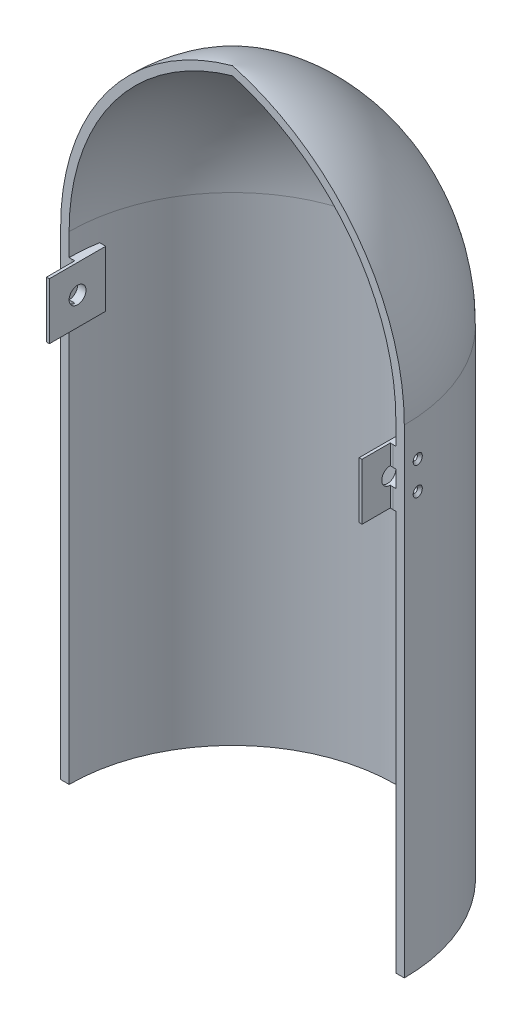
from build123d import *

# Parameters (mm, degrees)
REVOLVE1_ANGLE                                       = 180
SKETCH2_W                                            = 3
SKETCH2_H                                            = 20
BOSS_EXTRUDE1_DEPTH                                  = 10
SKETCH4_W                                            = 1
SKETCH4_H                                            = 20
CUT_EXTRUDE1_DEPTH                                   = 0.01
CSK_FOR_M1_6_COUNTERSUNK_FLAT_HEAD_SCREW_D           = 1.8
CSK_FOR_M1_6_COUNTERSUNK_FLAT_HEAD_SCREW_DEPTH       = 5
CSK_FOR_M1_6_COUNTERSUNK_FLAT_HEAD_SCREW_CSINK_D     = 3.6
CSK_FOR_M1_6_COUNTERSUNK_FLAT_HEAD_SCREW_CSINK_ANGLE = 90
CSK_FOR_M1_6_COUNTERSUNK_FLAT_HEAD_SCREW_TIP         = 0.540774557
CSK_FOR_M1_6_COUNTERSUNK_FLAT_HEAD_S_2_D             = 1.8
CSK_FOR_M1_6_COUNTERSUNK_FLAT_HEAD_S_2_DEPTH         = 5
CSK_FOR_M1_6_COUNTERSUNK_FLAT_HEAD_S_2_CSINK_D       = 3.6
CSK_FOR_M1_6_COUNTERSUNK_FLAT_HEAD_S_2_CSINK_ANGLE   = 90
CSK_FOR_M1_6_COUNTERSUNK_FLAT_HEAD_S_2_TIP           = 0.540774557
CSK_FOR_M1_6_COUNTERSUNK_FLAT_HEAD_S_3_D             = 1.8
CSK_FOR_M1_6_COUNTERSUNK_FLAT_HEAD_S_3_DEPTH         = 5
CSK_FOR_M1_6_COUNTERSUNK_FLAT_HEAD_S_3_CSINK_D       = 3.6
CSK_FOR_M1_6_COUNTERSUNK_FLAT_HEAD_S_3_CSINK_ANGLE   = 90
CSK_FOR_M1_6_COUNTERSUNK_FLAT_HEAD_S_3_TIP           = 0.540774557
SKETCH10_W                                           = 1
SKETCH10_H                                           = 20
BOSS_EXTRUDE2_DEPTH                                  = 10.01
SKETCH12_R                                           = 3
CUT_EXTRUDE4_DEPTH                                   = 3
CUT_EXTRUDE5_START                                   = -3
SKETCH13_R                                           = 3
CUT_EXTRUDE5_DEPTH                                   = 3


with BuildPart() as part:
    # Sketch1 → Revolve1 (revolve)
    with BuildSketch(Plane.XY):
        with BuildLine():
            Line((61, 170), (61, 0))
            Line((61, 0), (58, 0))
            Line((58, 0), (58, 170))
            ThreePointArc((58, 170), (41.873834296, 218.154039035), (0, 246.884627213))
            Line((0, 246.884627213), (0, 250))
            ThreePointArc((0, 250), (44.010282534, 220.301590432), (61, 170))
        make_face()
    revolve(axis=Axis((0, 0, 0), (0, 1, 0)), revolution_arc=REVOLVE1_ANGLE)

    # Sketch2 → Boss-Extrude1 (add)
    with BuildSketch(Plane.XY):
        with Locations((56.5, 152)):
            Rectangle(SKETCH2_W, SKETCH2_H)
        with Locations((-56.5, 152)):
            Rectangle(SKETCH2_W, SKETCH2_H)
    extrude(amount=-BOSS_EXTRUDE1_DEPTH)

    # Sketch4 → Cut-Extrude1 (cut)
    with BuildSketch(Plane.XY):
        with Locations((-56.5, 152)):
            Rectangle(SKETCH4_W, SKETCH4_H)
        with Locations((56.5, 152)):
            Rectangle(SKETCH4_W, SKETCH4_H)
    extrude(amount=-CUT_EXTRUDE1_DEPTH, mode=Mode.SUBTRACT)

    # CSK for M1.6 Countersunk Flat Head Screw2
    with Locations(Plane(origin=(60.795081967, 157.001615154, -4.995799095), x_dir=(0.081898345823, 0, 0.996640687987), z_dir=(0.996640687987, 0, -0.081898345823))):
        with Locations((0, 0)):
            CounterSinkHole(CSK_FOR_M1_6_COUNTERSUNK_FLAT_HEAD_SCREW_D / 2, CSK_FOR_M1_6_COUNTERSUNK_FLAT_HEAD_SCREW_CSINK_D / 2, depth=CSK_FOR_M1_6_COUNTERSUNK_FLAT_HEAD_SCREW_DEPTH, counter_sink_angle=CSK_FOR_M1_6_COUNTERSUNK_FLAT_HEAD_SCREW_CSINK_ANGLE)
            with Locations((0, 0, -(CSK_FOR_M1_6_COUNTERSUNK_FLAT_HEAD_SCREW_DEPTH + CSK_FOR_M1_6_COUNTERSUNK_FLAT_HEAD_SCREW_TIP / 2))):  # 118° drill point
                Cone(0, CSK_FOR_M1_6_COUNTERSUNK_FLAT_HEAD_SCREW_D / 2, CSK_FOR_M1_6_COUNTERSUNK_FLAT_HEAD_SCREW_TIP, mode=Mode.SUBTRACT)

    # CSK for M1.6 Countersunk Flat Head S 2
    with Locations(Plane(origin=(60.795081967, 147.001615154, -4.995799095), x_dir=(0.081897976852, 0, 0.996640718307), z_dir=(0.996640718307, 0, -0.081897976852))):
        with Locations((0, 0)):
            CounterSinkHole(CSK_FOR_M1_6_COUNTERSUNK_FLAT_HEAD_S_2_D / 2, CSK_FOR_M1_6_COUNTERSUNK_FLAT_HEAD_S_2_CSINK_D / 2, depth=CSK_FOR_M1_6_COUNTERSUNK_FLAT_HEAD_S_2_DEPTH, counter_sink_angle=CSK_FOR_M1_6_COUNTERSUNK_FLAT_HEAD_S_2_CSINK_ANGLE)
            with Locations((0, 0, -(CSK_FOR_M1_6_COUNTERSUNK_FLAT_HEAD_S_2_DEPTH + CSK_FOR_M1_6_COUNTERSUNK_FLAT_HEAD_S_2_TIP / 2))):  # 118° drill point
                Cone(0, CSK_FOR_M1_6_COUNTERSUNK_FLAT_HEAD_S_2_D / 2, CSK_FOR_M1_6_COUNTERSUNK_FLAT_HEAD_S_2_TIP, mode=Mode.SUBTRACT)

    # CSK for M1.6 Countersunk Flat Head S 3
    with Locations(Plane(origin=(-60.795081967, 147.001615154, -4.995799095), x_dir=(0.081897976852, 0, -0.996640718307), z_dir=(-0.996640718307, 0, -0.081897976852))):
        with Locations((0, 0), (0, -10)):
            CounterSinkHole(CSK_FOR_M1_6_COUNTERSUNK_FLAT_HEAD_S_3_D / 2, CSK_FOR_M1_6_COUNTERSUNK_FLAT_HEAD_S_3_CSINK_D / 2, depth=CSK_FOR_M1_6_COUNTERSUNK_FLAT_HEAD_S_3_DEPTH, counter_sink_angle=CSK_FOR_M1_6_COUNTERSUNK_FLAT_HEAD_S_3_CSINK_ANGLE)
            with Locations((0, 0, -(CSK_FOR_M1_6_COUNTERSUNK_FLAT_HEAD_S_3_DEPTH + CSK_FOR_M1_6_COUNTERSUNK_FLAT_HEAD_S_3_TIP / 2))):  # 118° drill point
                Cone(0, CSK_FOR_M1_6_COUNTERSUNK_FLAT_HEAD_S_3_D / 2, CSK_FOR_M1_6_COUNTERSUNK_FLAT_HEAD_S_3_TIP, mode=Mode.SUBTRACT)

    # Sketch10 → Boss-Extrude2 (add)
    with BuildSketch(Plane.XY.offset(-0.01)):
        with Locations((-55.5, 152)):
            Rectangle(SKETCH10_W, SKETCH10_H)
        with Locations((55.5, 152)):
            Rectangle(SKETCH10_W, SKETCH10_H)
    extrude(amount=BOSS_EXTRUDE2_DEPTH)

    # Sketch12 → Cut-Extrude4 (cut)
    with BuildSketch(Plane(origin=(-55, 0, 0), x_dir=(0, 0, -1), z_dir=(1, 0, 0))):
        with Locations((0, 152)):
            Circle(SKETCH12_R)
    extrude(amount=-CUT_EXTRUDE4_DEPTH, mode=Mode.SUBTRACT)

    # Sketch13 → Cut-Extrude5 (cut)
    with BuildSketch(Plane.ZY.offset(-55).offset(CUT_EXTRUDE5_START)):
        with Locations(Location((0, 152, 0), (0, 0, 180))):
            Circle(SKETCH13_R)
    extrude(amount=CUT_EXTRUDE5_DEPTH, mode=Mode.SUBTRACT)


solid = part.part
